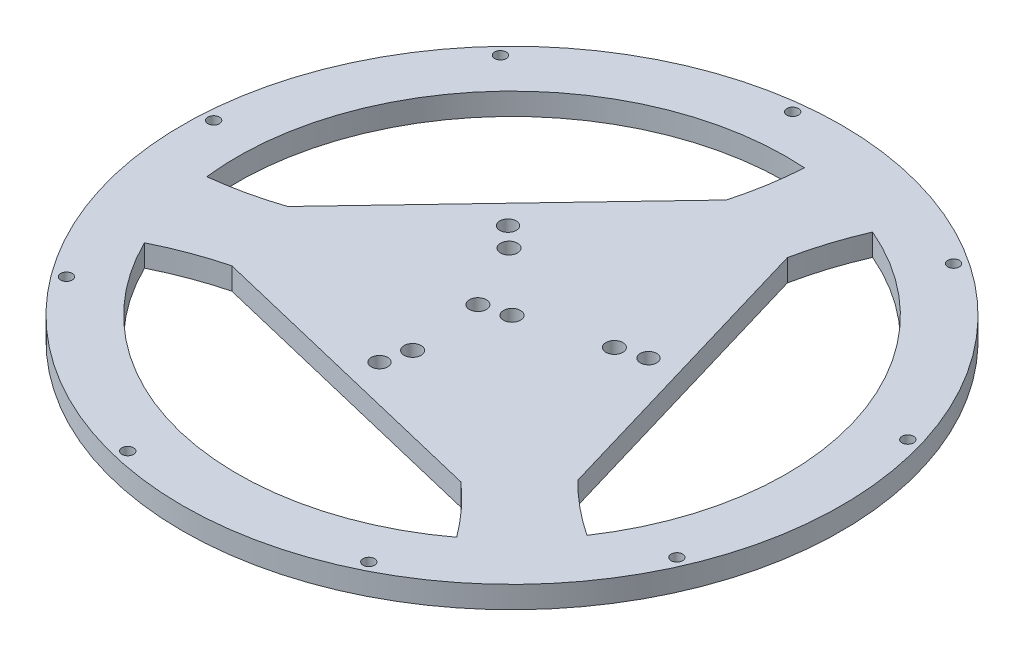
from build123d import *

# Parameters (mm, degrees)
SKETCH_3_R           = 60
SKETCH_3_R_2         = 1.052935028
SKETCH_3_R_3         = 1.5
SKETCH_3_R_4         = 1.55
EXTRUDE_4_DEPTH      = 4
CUT_EXTRUDE_15_DEPTH = 4
SKETCH_3_22_R        = 1.55
CUT_EXTRUDE_23_DEPTH = 10
SKETCH_3_23_R        = 1.052935028
CUT_EXTRUDE_24_DEPTH = 10


with BuildPart() as part:
    # 草图3 → 凸台-拉伸4 (new body)
    with BuildSketch(Plane(origin=(0, 0, 0), x_dir=(1, 0, 0), z_dir=(0, 1, 0))):
        with Locations(Location((0, 0, 0), (0, 0, 270))):
            Circle(SKETCH_3_R)
        with Locations(Location((-46.641583195, -34.475537952, 0), (0, 0, 270))):
            Circle(SKETCH_3_R_2, mode=Mode.SUBTRACT)
        with Locations(Location((-13.569076992, -56.390426045, 0), (0, 0, 270))):
            Circle(SKETCH_3_R_2, mode=Mode.SUBTRACT)
        with BuildLine():
            ThreePointArc((-44.889569885, -22.021047103), (-39.209954392, -19.560908928), (-33.307112163, -17.698983687))
            Line((-33.307112163, -17.698983687), (21.609631998, -30.913452559))
            ThreePointArc((21.609631998, -30.913452559), (26.019303967, -35.256850436), (29.958048994, -40.031428909))
            ThreePointArc((29.958048994, -40.031428909), (-11.697480165, -48.612436246), (-44.889569885, -22.021047103))
        make_face(mode=Mode.SUBTRACT)
        with Locations(Location((-4.678992066, -19.444974498, 0), (0, 0, 270))):
            Circle(SKETCH_3_R_3, mode=Mode.SUBTRACT)
        with Locations(Location((-3.50924405, -14.583730874, 0), (0, 0, 270))):
            Circle(SKETCH_3_R_4, mode=Mode.SUBTRACT)
        with Locations(Location((-4.794834481, -1.417590314, 0), (0, 0, 270))):
            Circle(SKETCH_3_R_4, mode=Mode.SUBTRACT)
        with Locations(Location((25.852551139, -51.919607083, 0), (0, 0, 270))):
            Circle(SKETCH_3_R_2, mode=Mode.SUBTRACT)
        with Locations(Location((53.177483273, -23.155026944, 0), (0, 0, 270))):
            Circle(SKETCH_3_R_2, mode=Mode.SUBTRACT)
        with Locations(Location((-10.875259394, 10.330959932, 0), (0, 0, 270))):
            Circle(SKETCH_3_R_4, mode=Mode.SUBTRACT)
        with Locations(Location((-14.500345858, 13.774613243, 0), (0, 0, 270))):
            Circle(SKETCH_3_R_3, mode=Mode.SUBTRACT)
        with BuildLine():
            ThreePointArc((15.967019236, 34.171216556), (17.523676152, 40.161803442), (19.689209887, 45.960145931))
            ThreePointArc((19.689209887, 45.960145931), (47.948344812, 14.175903139), (41.515571152, -27.864984334))
            ThreePointArc((41.515571152, -27.864984334), (36.545221249, -24.176362121), (31.981325576, -19.995313417))
            Line((31.981325576, -19.995313417), (15.967019236, 34.171216556))
        make_face(mode=Mode.SUBTRACT)
        with Locations(Location((55.620079982, 16.444047642, 0), (0, 0, 270))):
            Circle(SKETCH_3_R_2, mode=Mode.SUBTRACT)
        with Locations(Location((32.037423118, 48.34876958, 0), (0, 0, 270))):
            Circle(SKETCH_3_R_2, mode=Mode.SUBTRACT)
        with Locations(Location((-42.05100299, 39.946378404, 0), (0, 0, 270))):
            Circle(SKETCH_3_R_2, mode=Mode.SUBTRACT)
        with Locations(Location((-6.535900078, 57.630564895, 0), (0, 0, 270))):
            Circle(SKETCH_3_R_2, mode=Mode.SUBTRACT)
        with Locations(Location((14.384503444, 4.252770942, 0), (0, 0, 270))):
            Circle(SKETCH_3_R_4, mode=Mode.SUBTRACT)
        with Locations(Location((19.179337925, 5.670361256, 0), (0, 0, 270))):
            Circle(SKETCH_3_R_3, mode=Mode.SUBTRACT)
    extrude(amount=EXTRUDE_4_DEPTH)

    # 草图3<17> → 切除-拉伸15 (cut)
    with BuildSketch(Plane(origin=(0, 0, 0), x_dir=(1, 0, 0), z_dir=(0, 1, 0))):
        with BuildLine():
            Line((1.325786588, 37.694297104), (-37.576651234, -3.257763997))
            ThreePointArc((-37.576651234, -3.257763997), (-43.542980118, -4.904953006), (-49.647258882, -5.928717023))
            ThreePointArc((-49.647258882, -5.928717023), (-36.250864646, 34.436533107), (3.373998733, 49.886031437))
            ThreePointArc((3.373998733, 49.886031437), (2.664733143, 43.737271049), (1.325786588, 37.694297104))
        make_face()
    extrude(amount=CUT_EXTRUDE_15_DEPTH, mode=Mode.SUBTRACT)

    # 草图3<22> → 切除-拉伸23 (cut)
    with BuildSketch(Plane(origin=(0, 0, 0), x_dir=(1, 0, 0), z_dir=(0, 1, 0))):
        with Locations(Location((0, 0, 0), (0, 0, 270))):
            Circle(SKETCH_3_22_R)
    extrude(amount=CUT_EXTRUDE_23_DEPTH, mode=Mode.SUBTRACT)

    # 草图3<23> → 切除-拉伸24 (cut)
    with BuildSketch(Plane(origin=(0, 0, 0), x_dir=(1, 0, 0), z_dir=(0, 1, 0))):
        with Locations(Location((-57.889974257, 3.570837502, 0), (0, 0, 270))):
            Circle(SKETCH_3_23_R)
    extrude(amount=CUT_EXTRUDE_24_DEPTH, mode=Mode.SUBTRACT)


solid = part.part
